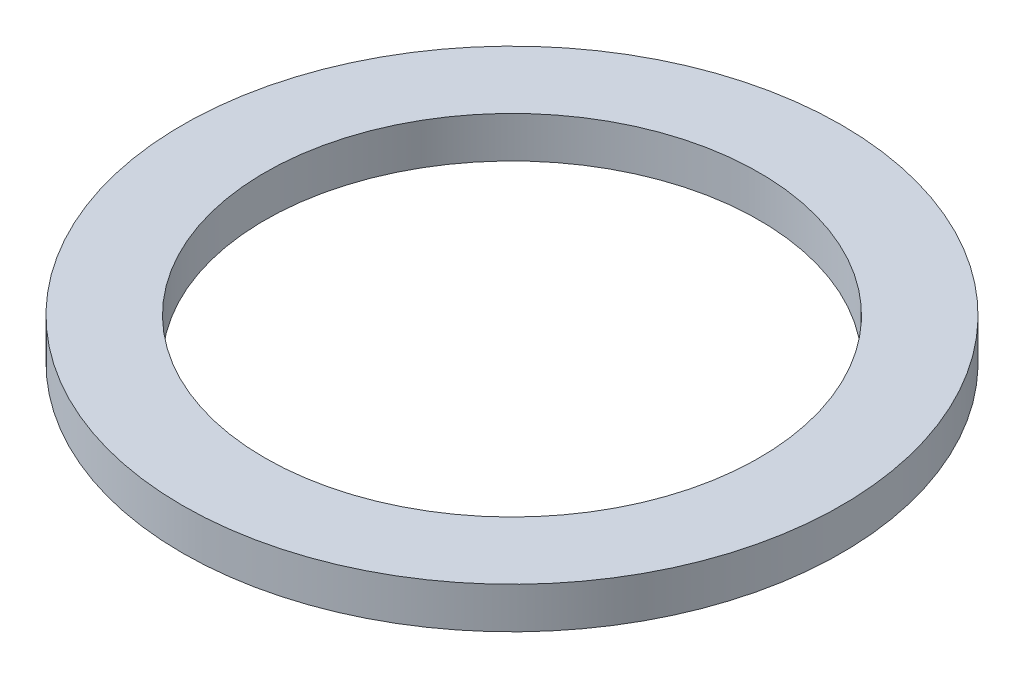
from build123d import *

# Parameters (mm, degrees)
SKETCH1_R           = 8
SKETCH1_R_2         = 6
BOSS_EXTRUDE1_DEPTH = 1


with BuildPart() as part:
    # Sketch1 → Boss-Extrude1 (new body)
    with BuildSketch(Plane(origin=(0, 0, 0), x_dir=(1, 0, 0), z_dir=(0, 1, 0))):
        with Locations(Location((0, 0, 0), (0, 0, 270))):
            Circle(SKETCH1_R)
        with Locations(Location((0, 0, 0), (0, 0, 270))):
            Circle(SKETCH1_R_2, mode=Mode.SUBTRACT)
    extrude(amount=BOSS_EXTRUDE1_DEPTH)


solid = part.part
